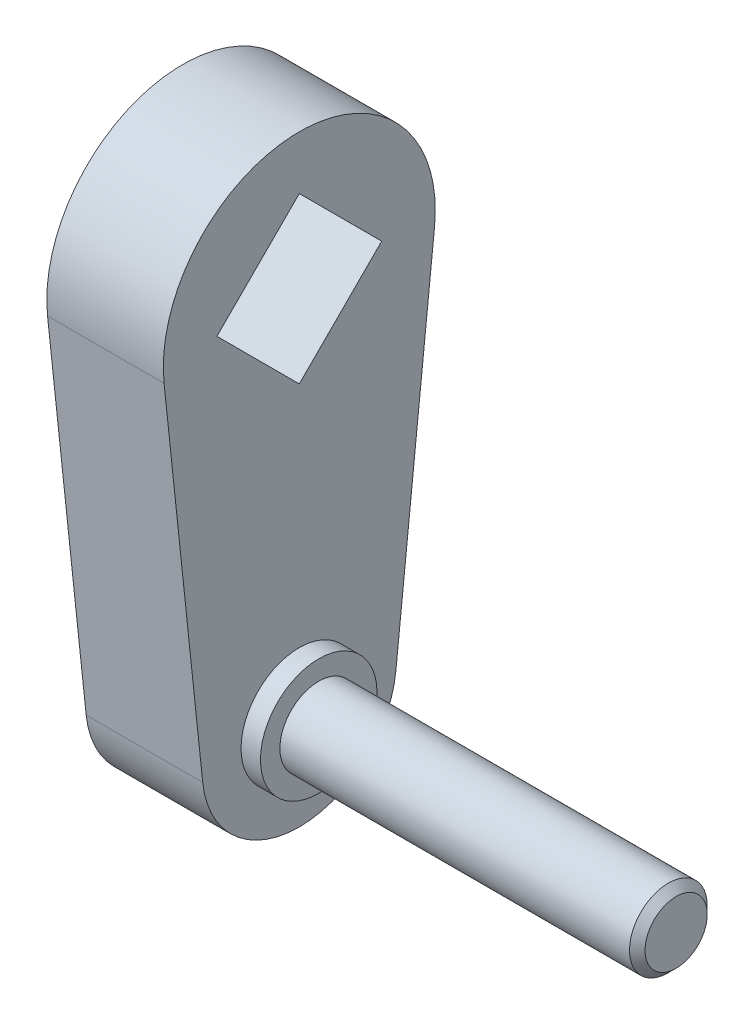
from build123d import *

# Parameters (mm, degrees)
SKETCH_4_R      = 10
EXTRUDE_4_DEPTH = 30
SKETCH_5_R      = 10
EXTRUDE_5_DEPTH = 28
SKETCH_6_R      = 15
EXTRUDE_6_DEPTH = 5
EXTRUDE_START   = 92
SKETCH_7_R      = 10
EXTRUDE_7_DEPTH = 92
CHAMFER_2_SIZE  = 2


with BuildPart() as part:
    # 草图4 → 凸台-拉伸4 (new body)
    with BuildSketch(Plane(origin=(0, 0, 0), x_dir=(0, 0, -1), z_dir=(1, 0, 0))):
        with BuildLine():
            Line((-34.805554051, -3.684210526), (-24.861110036, -97.631578947))
            ThreePointArc((-24.861110036, -97.631578947), (0, -120), (24.861110036, -97.631578947))
            Line((24.861110036, -97.631578947), (34.805554051, -3.684210526))
            ThreePointArc((34.805554051, -3.684210526), (0, 35), (-34.805554051, -3.684210526))
        make_face()
        with Locations((0, -95)):
            Circle(SKETCH_4_R, mode=Mode.SUBTRACT)
        Polygon((0, 21.213203436), (21.213203436, 0), (0, -21.213203436), (-21.213203436, 0), align=None, mode=Mode.SUBTRACT)
    extrude(amount=-EXTRUDE_4_DEPTH)

    # 草图5 → 凸台-拉伸5 (add)
    with BuildSketch(Plane(origin=(0, 0, 0), x_dir=(0, 0, -1), z_dir=(1, 0, 0))):
        with Locations((0, -95)):
            Circle(SKETCH_5_R)
    extrude(amount=-EXTRUDE_5_DEPTH)

    # 草图6 → 凸台-拉伸6 (add)
    with BuildSketch(Plane(origin=(0, 0, 0), x_dir=(0, 0, -1), z_dir=(1, 0, 0))):
        with Locations(Location((0, -95, 0), (0, 0, 180))):
            Circle(SKETCH_6_R)
    extrude(amount=EXTRUDE_6_DEPTH)

    # 草图7 → 凸台-拉伸7 (add)
    with BuildSketch(Plane(origin=(5, 0, 0), x_dir=(0, 0, -1), z_dir=(1, 0, 0)).offset(EXTRUDE_START)):
        with Locations((0, -95)):
            Circle(SKETCH_7_R)
    extrude(amount=-EXTRUDE_7_DEPTH)

    # 倒角2
    chamfer_2_edges = [part.edges().sort_by_distance(p)[0] for p in [
        (97, -95, 10),
    ]]
    chamfer(chamfer_2_edges, length=CHAMFER_2_SIZE)


solid = part.part
